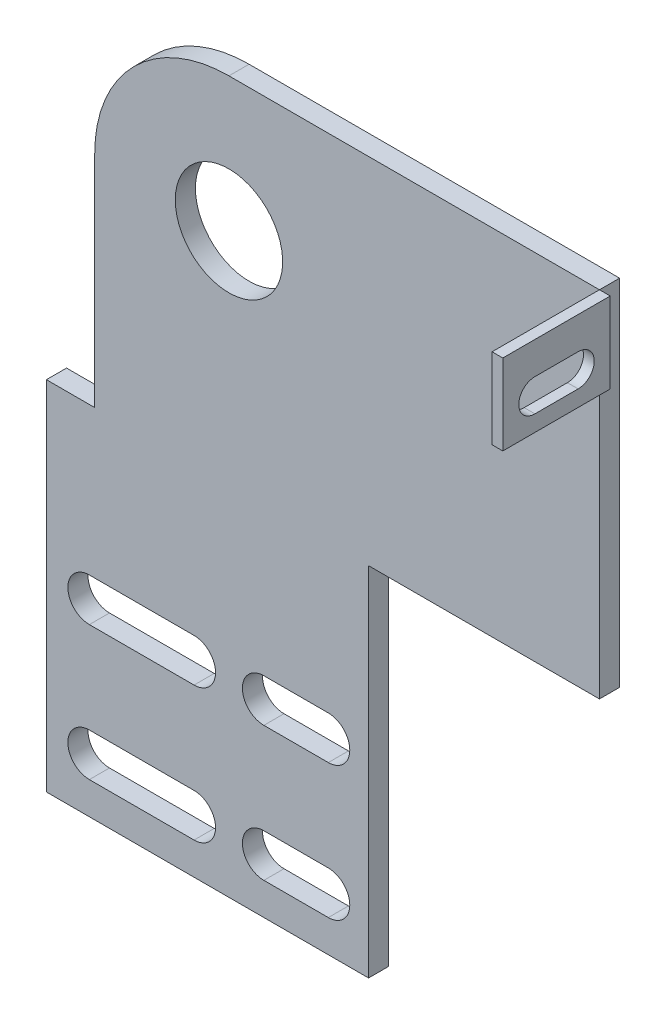
from build123d import *

# Parameters (mm, degrees)
SKETCH1_W           = 130.81
SKETCH1_H           = 168.275
BOSS_EXTRUDE1_DEPTH = 4.7625
SKETCH2_OUTSIDE_W   = 175.448
SKETCH2_OUTSIDE_H   = 212.913
SKETCH2_OUTSIDE_R   = 12.7
CUT_EXTRUDE1_DEPTH  = 214.191024978
SKETCH3_W           = 25.4
SKETCH3_H           = 19.05
BOSS_EXTRUDE2_DEPTH = 2.54


with BuildPart() as part:
    # Sketch1 → Boss-Extrude1 (new body)
    with BuildSketch(Plane.XY):
        with Locations((65.405, 84.1375)):
            Rectangle(SKETCH1_W, SKETCH1_H)
    extrude(amount=BOSS_EXTRUDE1_DEPTH)

    # Sketch2 outside → Cut-Extrude1 (cut, through all)
    # profile 1 of 6: a face of its own
    with BuildSketch(Plane.XY):
        with Locations((65.405, 84.1375)):
            Rectangle(SKETCH2_OUTSIDE_W, SKETCH2_OUTSIDE_H)
        with BuildLine():
            Line((0, 84.455), (11.43, 84.455))
            Line((11.43, 84.455), (11.43, 136.525))
            ThreePointArc((11.43, 136.525), (20.729359697, 158.975640303), (43.18, 168.275))
            Line((43.18, 168.275), (130.81, 168.275))
            Line((130.81, 168.275), (130.81, 84.455))
            Line((130.81, 84.455), (76.2, 84.455))
            Line((76.2, 84.455), (76.2, 0))
            Line((76.2, 0), (0, 0))
            Line((0, 0), (0, 84.455))
        make_face(mode=Mode.SUBTRACT)
    # profile 2 of 6: a face of its own
    with BuildSketch(Plane.XY):
        with Locations(Location((43.18, 136.525, 0), (0, 0, 180))):
            Circle(SKETCH2_OUTSIDE_R)
    # profile 3 of 6: a face of its own
    with BuildSketch(Plane.XY):
        with BuildLine():
            Line((10.16, 49.53), (34.925, 49.53))
            ThreePointArc((34.925, 49.53), (40.005, 44.45), (34.925, 39.37))
            Line((34.925, 39.37), (10.16, 39.37))
            ThreePointArc((10.16, 39.37), (5.08, 44.45), (10.16, 49.53))
        make_face()
    # profile 4 of 6: a face of its own
    with BuildSketch(Plane.XY):
        with BuildLine():
            Line((10.16, 17.78), (34.925, 17.78))
            ThreePointArc((34.925, 17.78), (40.005, 12.7), (34.925, 7.62))
            Line((34.925, 7.62), (10.16, 7.62))
            ThreePointArc((10.16, 7.62), (5.08, 12.7), (10.16, 17.78))
        make_face()
    # profile 5 of 6: a face of its own
    with BuildSketch(Plane.XY):
        with BuildLine():
            Line((51.435, 49.53), (66.675, 49.53))
            ThreePointArc((66.675, 49.53), (71.755, 44.45), (66.675, 39.37))
            Line((66.675, 39.37), (51.435, 39.37))
            ThreePointArc((51.435, 39.37), (46.355, 44.45), (51.435, 49.53))
        make_face()
    # profile 6 of 6: a face of its own
    with BuildSketch(Plane.XY):
        with BuildLine():
            Line((51.435, 17.78), (66.675, 17.78))
            ThreePointArc((66.675, 17.78), (71.755, 12.7), (66.675, 7.62))
            Line((66.675, 7.62), (51.435, 7.62))
            ThreePointArc((51.435, 7.62), (46.355, 12.7), (51.435, 17.78))
        make_face()
    extrude(amount=CUT_EXTRUDE1_DEPTH, mode=Mode.SUBTRACT)


with BuildPart() as body_2:
    # Sketch3 → Boss-Extrude2 (new body)
    with BuildSketch(Plane(origin=(130.81, 0, 0), x_dir=(0, 0, -1), z_dir=(1, 0, 0))):
        with Locations((-17.4625, 158.75)):
            Rectangle(SKETCH3_W, SKETCH3_H)
        with BuildLine():
            Line((-22.572792052, 160.655), (-12.352207948, 160.655))
            ThreePointArc((-12.352207948, 160.655), (-8.542207948, 156.845), (-12.352207948, 153.035))
            Line((-12.352207948, 153.035), (-22.572792052, 153.035))
            ThreePointArc((-22.572792052, 153.035), (-26.382792052, 156.845), (-22.572792052, 160.655))
        make_face(mode=Mode.SUBTRACT)
    extrude(amount=BOSS_EXTRUDE2_DEPTH)


solid = Compound([part.part, body_2.part])
